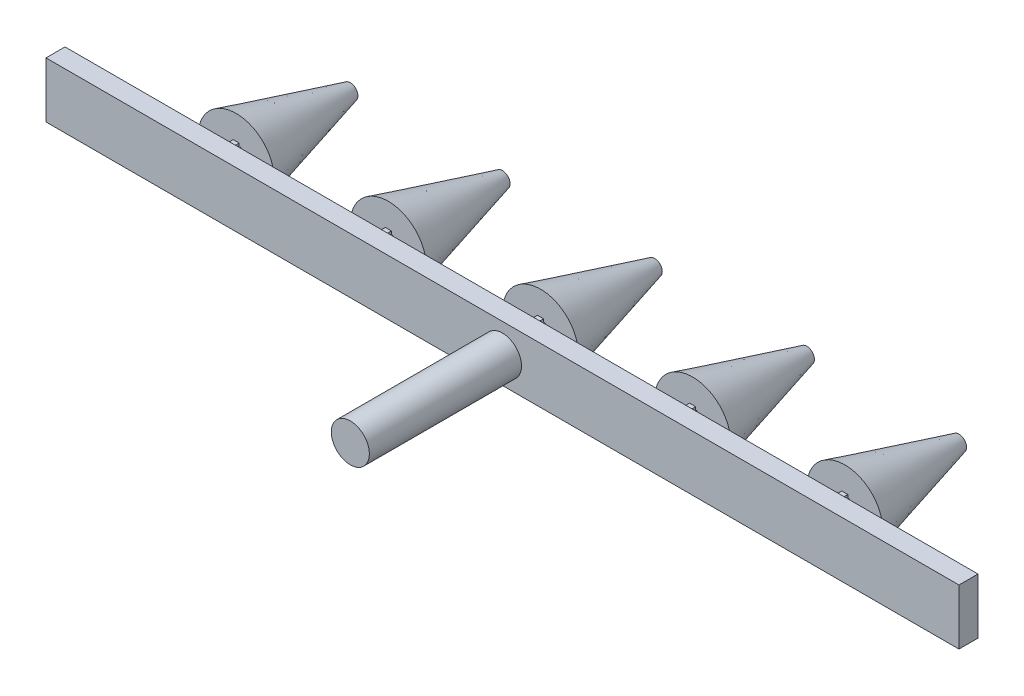
from build123d import *

# Parameters (mm, degrees)
BOSS_EXTRUDE1_DEPTH   = 25
BOSS_EXTRUDE1_2_DEPTH = 25
BOSS_EXTRUDE1_3_DEPTH = 25
BOSS_EXTRUDE1_4_DEPTH = 25
BOSS_EXTRUDE1_5_DEPTH = 25
SKETCH3_R             = 6
CUT_EXTRUDE1_DEPTH    = 150
SKETCH11_R            = 10
SKETCH11_R_2          = 6
CUT_EXTRUDE2_DEPTH    = 150
SKETCH12_W            = 25
SKETCH12_H            = 73
BOSS_EXTRUDE2_DEPTH   = 1200
SKETCH13_R            = 25
BOSS_EXTRUDE3_DEPTH   = 200
SCALE1_SCALE          = 0.6


with BuildPart() as part:
    # Sketch1 → Boss-Extrude1 (new body)
    with BuildSketch(Plane.XY):
        with BuildLine():
            Line((4, 18), (-4, 18))
            Line((-4, 18), (-4, 14.456832295))
            ThreePointArc((-4, 14.456832295), (0, -15), (4, 14.456832295))
            Line((4, 14.456832295), (4, 18))
        make_face()
    extrude(amount=-BOSS_EXTRUDE1_DEPTH)

    # Sketch2 → Revolve1 (revolve)
    with BuildSketch(Plane(origin=(0, 0, 0), x_dir=(0, 0, -1), z_dir=(1, 0, 0)), mode=Mode.PRIVATE) as revolve1_sk:
        Polygon((25, -0.271583853), (175, -0.271583853), (175, 9.728416147), (25, 49.728416147), align=None)
    revolve(revolve1_sk.sketch.rotate(Axis((0, -0.271583853, -25), (0, 0, -1)), 180), axis=Axis((0, -0.271583853, -25), (0, 0, -1)))

    # Sketch3 → Cut-Extrude1 (cut)
    with BuildSketch(Plane(origin=(0, 0, -175), x_dir=(-1, 0, 0), z_dir=(0, 0, -1))):
        with Locations(Location((0, 0, 0), (0, 0, 90))):
            Circle(SKETCH3_R)
    extrude(amount=-CUT_EXTRUDE1_DEPTH, mode=Mode.SUBTRACT)



with BuildPart() as body_2:
    # Sketch1 → Boss-Extrude1 2 (new body)
    with BuildSketch(Plane.XY):
        with BuildLine():
            Line((204, 18), (196, 18))
            Line((196, 18), (196, 14.456832295))
            ThreePointArc((196, 14.456832295), (200, -15), (204, 14.456832295))
            Line((204, 14.456832295), (204, 18))
        make_face()
    extrude(amount=-BOSS_EXTRUDE1_2_DEPTH)

    # Sketch7 → Revolve2 (revolve)
    with BuildSketch(Plane(origin=(200, 0, 0), x_dir=(0, 0, -1), z_dir=(1, 0, 0)), mode=Mode.PRIVATE) as revolve2_sk:
        Polygon((25, -0.271583853), (175, -0.271583853), (175, 9.728416147), (25, 49.728416147), align=None)
    revolve(revolve2_sk.sketch.rotate(Axis((200, -0.271583853, -25), (0, 0, -1)), 180), axis=Axis((200, -0.271583853, -25), (0, 0, -1)))


with BuildPart() as body_3:
    # Sketch1 → Boss-Extrude1 3 (new body)
    with BuildSketch(Plane.XY):
        with BuildLine():
            Line((404, 18), (396, 18))
            Line((396, 18), (396, 14.456832295))
            ThreePointArc((396, 14.456832295), (400, -15), (404, 14.456832295))
            Line((404, 14.456832295), (404, 18))
        make_face()
    extrude(amount=-BOSS_EXTRUDE1_3_DEPTH)

    # Sketch8 → Revolve3 (revolve)
    with BuildSketch(Plane(origin=(400, 0, 0), x_dir=(0, 0, -1), z_dir=(1, 0, 0)), mode=Mode.PRIVATE) as revolve3_sk:
        Polygon((25, -0.271583853), (175, -0.271583853), (175, 9.728416147), (25, 49.728416147), align=None)
    revolve(revolve3_sk.sketch.rotate(Axis((400, -0.271583853, -25), (0, 0, -1)), 180), axis=Axis((400, -0.271583853, -25), (0, 0, -1)))


with BuildPart() as body_4:
    # Sketch1 → Boss-Extrude1 4 (new body)
    with BuildSketch(Plane.XY):
        with BuildLine():
            Line((604, 18), (596, 18))
            Line((596, 18), (596, 14.456832295))
            ThreePointArc((596, 14.456832295), (600, -15), (604, 14.456832295))
            Line((604, 14.456832295), (604, 18))
        make_face()
    extrude(amount=-BOSS_EXTRUDE1_4_DEPTH)

    # Sketch9 → Revolve4 (revolve)
    with BuildSketch(Plane(origin=(600, 0, 0), x_dir=(0, 0, -1), z_dir=(1, 0, 0)), mode=Mode.PRIVATE) as revolve4_sk:
        Polygon((25, -0.271583853), (175, -0.271583853), (175, 9.728416147), (25, 49.728416147), align=None)
    revolve(revolve4_sk.sketch.rotate(Axis((600, -0.271583853, -25), (0, 0, -1)), 180), axis=Axis((600, -0.271583853, -25), (0, 0, -1)))


with BuildPart() as body_5:
    # Sketch1 → Boss-Extrude1 5 (new body)
    with BuildSketch(Plane.XY):
        with BuildLine():
            Line((804, 18), (796, 18))
            Line((796, 18), (796, 14.456832295))
            ThreePointArc((796, 14.456832295), (800, -15), (804, 14.456832295))
            Line((804, 14.456832295), (804, 18))
        make_face()
    extrude(amount=-BOSS_EXTRUDE1_5_DEPTH)

    # Sketch10 → Revolve5 (revolve)
    with BuildSketch(Plane(origin=(800, 0, 0), x_dir=(0, 0, -1), z_dir=(1, 0, 0)), mode=Mode.PRIVATE) as revolve5_sk:
        Polygon((25, -0.271583853), (175, -0.271583853), (175, 9.728416147), (25, 49.728416147), align=None)
    revolve(revolve5_sk.sketch.rotate(Axis((800, -0.271583853, -25), (0, 0, -1)), 180), axis=Axis((800, -0.271583853, -25), (0, 0, -1)))


with BuildPart() as cut_extrude2_tool:
    # Sketch11 → Cut-Extrude2 (new body)
    # profile 1 of 5: a face of its own
    with BuildSketch(Plane(origin=(0, 0, -175), x_dir=(-1, 0, 0), z_dir=(0, 0, -1))):
        with Locations(Location((-200, -0.271583853, 0), (0, 0, 90))):
            Circle(SKETCH11_R)
        with Locations(Location((-200, -0.271583853, 0), (0, 0, 90))):
            Circle(SKETCH11_R_2, mode=Mode.SUBTRACT)
    # profile 2 of 5: a face of its own
    with BuildSketch(Plane(origin=(0, 0, -175), x_dir=(-1, 0, 0), z_dir=(0, 0, -1))):
        with Locations(Location((0, 0, 0), (0, 0, 90))):
            Circle(SKETCH11_R_2)
    # profile 3 of 5: a face of its own
    with BuildSketch(Plane(origin=(0, 0, -175), x_dir=(-1, 0, 0), z_dir=(0, 0, -1))):
        with Locations(Location((-400, -0.271583853, 0), (0, 0, 90))):
            Circle(SKETCH11_R_2)
    # profile 4 of 5: a face of its own
    with BuildSketch(Plane(origin=(0, 0, -175), x_dir=(-1, 0, 0), z_dir=(0, 0, -1))):
        with Locations(Location((-600, -0.271583853, 0), (0, 0, 90))):
            Circle(SKETCH11_R_2)
    # profile 5 of 5: a face of its own
    with BuildSketch(Plane(origin=(0, 0, -175), x_dir=(-1, 0, 0), z_dir=(0, 0, -1))):
        with Locations(Location((-800, -0.271583853, 0), (0, 0, 90))):
            Circle(SKETCH11_R_2)
    extrude(amount=-CUT_EXTRUDE2_DEPTH)


with BuildPart() as body_2_1:
    add(body_2.part)

    # Cut-Extrude2: cut by cut_extrude2_tool
    add(cut_extrude2_tool.part, mode=Mode.SUBTRACT)


with BuildPart() as body_3_1:
    add(body_3.part)

    # Cut-Extrude2: cut by cut_extrude2_tool
    add(cut_extrude2_tool.part, mode=Mode.SUBTRACT)


with BuildPart() as body_4_1:
    add(body_4.part)

    # Cut-Extrude2: cut by cut_extrude2_tool
    add(cut_extrude2_tool.part, mode=Mode.SUBTRACT)


with BuildPart() as body_5_1:
    add(body_5.part)

    # Cut-Extrude2: cut by cut_extrude2_tool
    add(cut_extrude2_tool.part, mode=Mode.SUBTRACT)


with BuildPart() as part_1:
    add(part.part)

    add(body_2_1.part)  # Boss-Extrude2 merges body 2

    add(body_3_1.part)  # Boss-Extrude2 merges body 3

    add(body_4_1.part)  # Boss-Extrude2 merges body 4

    add(body_5_1.part)  # Boss-Extrude2 merges body 5
    # Sketch12 → Boss-Extrude2 (add)
    with BuildSketch(Plane(origin=(1000, 0, 0), x_dir=(0, 0, -1), z_dir=(1, 0, 0))):
        with Locations((-12.5, 1.5)):
            Rectangle(SKETCH12_W, SKETCH12_H)
    extrude(amount=-BOSS_EXTRUDE2_DEPTH)

    # Sketch13 → Boss-Extrude3 (add)
    with BuildSketch(Plane.XY.offset(25)):
        with Locations((400, -0.271583853)):
            Circle(SKETCH13_R)
    extrude(amount=BOSS_EXTRUDE3_DEPTH)


with BuildPart() as part_2:
    # Scale1: scaled about (400.526633952, 0.517126038, -17.495206872)
    add(part_1.part.scale(SCALE1_SCALE).moved(Location((160.210653581, 0.206850415, -6.998082749))))


solid = part_2.part
